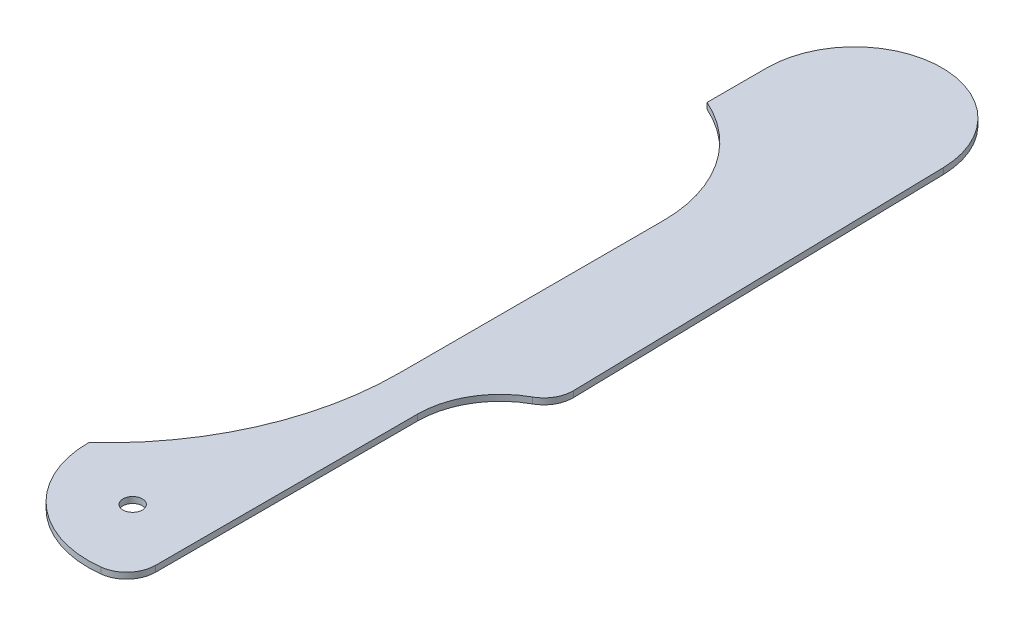
from build123d import *

# Parameters (mm, degrees)
BOSS_EXTRUDE1_DEPTH = 0.625
SKETCH2_R           = 1
CUT_EXTRUDE1_DEPTH  = 2
SCALE1_SCALE        = 0.6


with BuildPart() as part:
    # Sketch1 → Boss-Extrude1 (new body)
    with BuildSketch(Plane(origin=(0, 0, 0), x_dir=(1, 0, 0), z_dir=(0, 1, 0))):
        with BuildLine():
            Line((8.997858244, 0.196333965), (9.848841271, -38.803666035))
            ThreePointArc((9.848841271, -38.803666035), (9.449049837, -40.366651199), (8.297497314, -41.496555))
            ThreePointArc((8.297497314, -41.496555), (5.081486735, -44.617860887), (3.9, -48.940980546))
            Line((3.9, -48.940980546), (3.9, -75.940980546))
            ThreePointArc((3.9, -75.940980546), (3.144994432, -77.930955421), (1.26, -78.919302221))
            ThreePointArc((1.26, -78.919302221), (-6.994111479, -76.326677148), (-10.499709039, -68.417009214))
            ThreePointArc((-10.499709039, -68.417009214), (-3.259075008, -58.361278544), (-0.7, -46.237102878))
            Line((-0.7, -46.237102878), (-0.7, -18.987102878))
            ThreePointArc((-0.7, -18.987102878), (-2.95691693, -11.364767277), (-9, -6.2))
            Line((-9, -6.2), (-9, 0))
            ThreePointArc((-9, 0), (-0.098172823, 8.999464545), (8.997858244, 0.196333965))
        make_face()
    extrude(amount=BOSS_EXTRUDE1_DEPTH)

    # Sketch2 → Cut-Extrude1 (cut)
    with BuildSketch(Plane(origin=(0, 0.625, 0), x_dir=(1, 0, 0), z_dir=(0, 1, 0))):
        with Locations(Location((-2.716354086, -71.695176359, 0), (0, 0, 270))):
            Circle(SKETCH2_R)
    extrude(amount=-CUT_EXTRUDE1_DEPTH, mode=Mode.SUBTRACT)


with BuildPart() as part_1:
    # Scale1: scaled about (1.258353423, 0.3125, 30.69527069)
    add(part.part.scale(SCALE1_SCALE).moved(Location((0.503341369, 0.125, 12.278108276))))


solid = part_1.part
